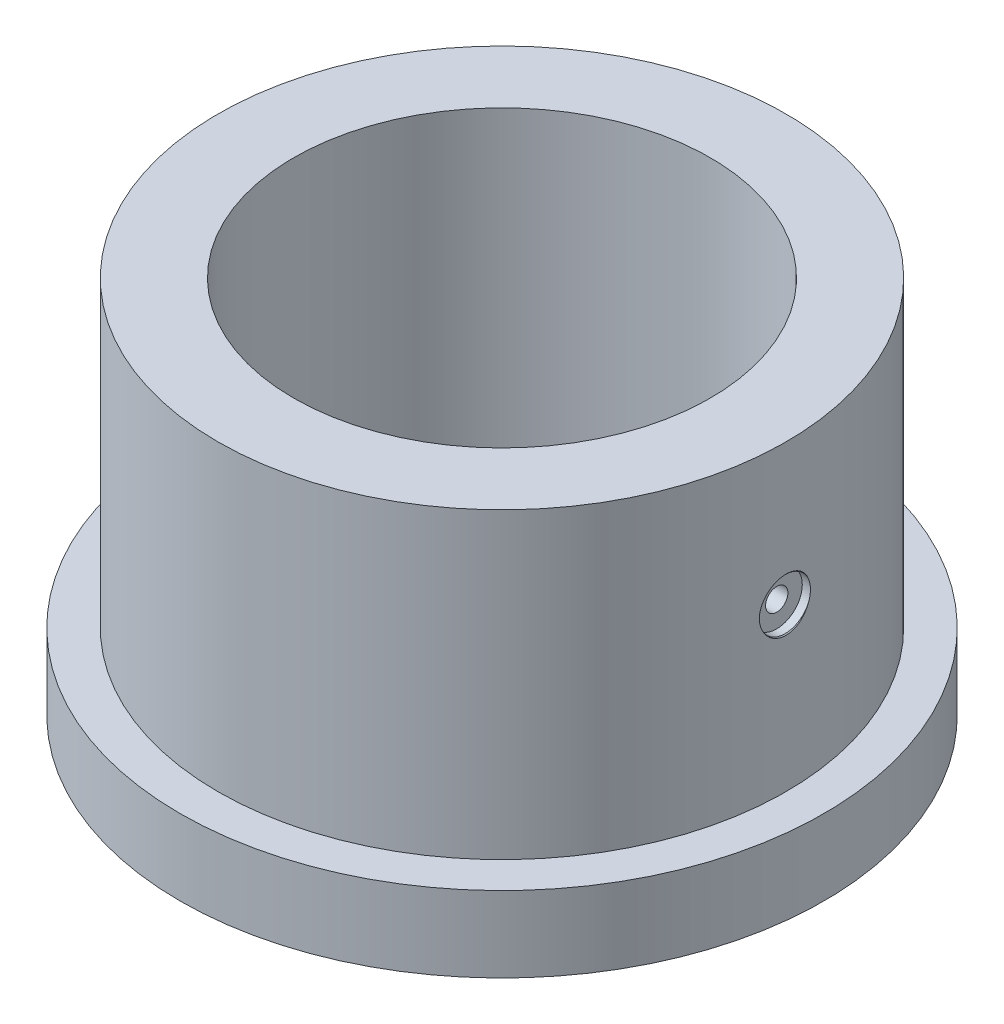
from build123d import *

# Parameters (mm, degrees)
SKETCH1_R               = 37.5
BOSS_EXTRUDE1_DEPTH     = 40
SKETCH2_R               = 42.5
BOSS_EXTRUDE2_DEPTH     = 10
CUT_EXTRUDE1_DEPTH      = 40
CUT_EXTRUDE1_DEPTH_BACK = 10
SKETCH3_R               = 27.5


with BuildPart() as part:
    # Sketch1 → Boss-Extrude1 (new body)
    with BuildSketch(Plane(origin=(0, 0, 0), x_dir=(1, 0, 0), z_dir=(0, 1, 0))):
        with Locations(Location((0, 0, 0), (0, 0, 270))):
            Circle(SKETCH1_R)
    extrude(amount=BOSS_EXTRUDE1_DEPTH)

    # Sketch2 → Boss-Extrude2 (add)
    with BuildSketch(Plane(origin=(0, 0, 0), x_dir=(1, 0, 0), z_dir=(0, 1, 0))):
        with Locations(Location((0, 0, 0), (0, 0, 270))):
            Circle(SKETCH2_R)
    extrude(amount=-BOSS_EXTRUDE2_DEPTH)

    # Sketch3 → Cut-Extrude1 (cut, two sides: drawn at the far end of the back side and taken through both)
    with BuildSketch(Plane(origin=(0, 0, 0), x_dir=(1, 0, 0), z_dir=(0, 1, 0)).offset(-CUT_EXTRUDE1_DEPTH_BACK)):
        with Locations(Location((0, 0, 0), (0, 0, 270))):
            Circle(SKETCH3_R)
    extrude(amount=CUT_EXTRUDE1_DEPTH + CUT_EXTRUDE1_DEPTH_BACK, mode=Mode.SUBTRACT)

    # Sketch12 → CBORE for #4 Binding Head Machine Screw1 (revolve, cut)
    with BuildSketch(Plane(origin=(38, 21.382704805, 0), x_dir=(0, 0, -1), z_dir=(0, 1, 0))):
        Polygon((0, 0), (0, 18.885187864), (1.4732, 18), (1.4732, 1.7272), (3.37312, 1.7272), (3.37312, 0.624012762), (4.00812, 0), align=None)
    revolve(axis=Axis((44.35, 21.382704805, 0), (-1, 0, 0)), mode=Mode.SUBTRACT)


solid = part.part
